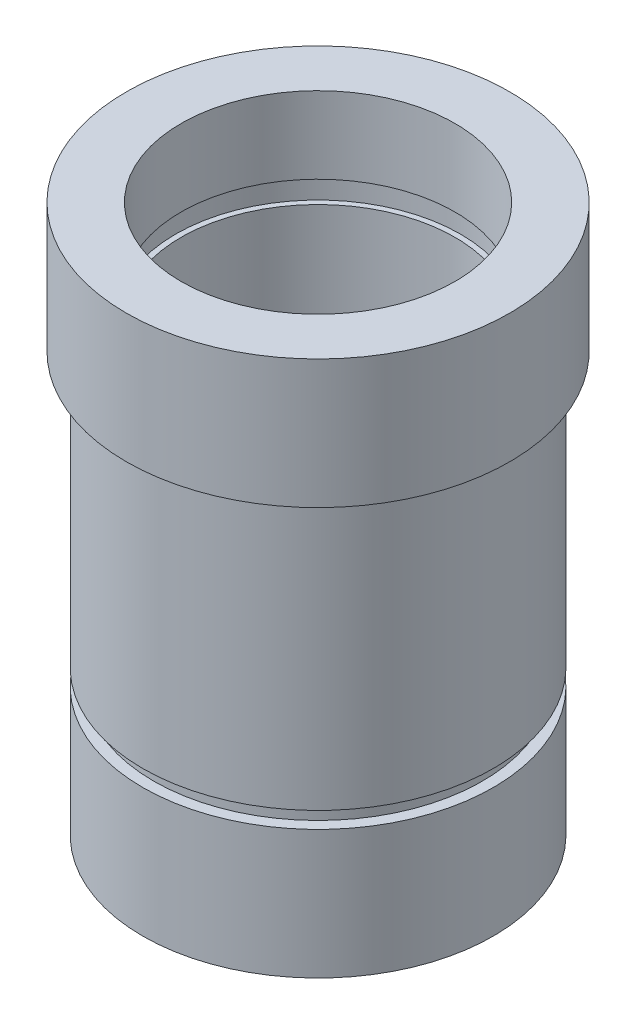
from build123d import *

# Parameters (mm, degrees)
SKETCH2_R          = 12.5
CUT_EXTRUDE1_DEPTH = 56.789784011
SKETCH3_R          = 13
CUT_EXTRUDE2_DEPTH = 2
CUT_EXTRUDE3_START = -2
SKETCH4_R          = 13
CUT_EXTRUDE3_DEPTH = 2


with BuildPart() as part:
    # Sketch1 → Revolve1 (revolve)
    with BuildSketch(Plane.XY, mode=Mode.PRIVATE) as revolve1_sk:
        Polygon((0, 23.132117765), (17.5, 23.132117765), (17.5, 11.382117765), (16, 11.382117765), (16, -13.617882235), (15, -13.617882235), (15, -15.117882235), (16, -15.117882235), (16, -26.867882235), (0, -26.867882235), align=None)
    revolve(revolve1_sk.sketch.rotate(Axis((0, 23.362720403, 0), (0, -1, 0)), 90), axis=Axis((0, 23.362720403, 0), (0, -1, 0)))

    # Sketch2 → Cut-Extrude1 (cut, through all)
    with BuildSketch(Plane(origin=(0, 23.132117765, 0), x_dir=(1, 0, 0), z_dir=(0, 1, 0))):
        with Locations(Location((0, 0, 0), (0, 0, 270))):
            Circle(SKETCH2_R)
    extrude(amount=-CUT_EXTRUDE1_DEPTH, mode=Mode.SUBTRACT)

    # Sketch3 → Cut-Extrude2 (cut)
    with BuildSketch(Plane(origin=(0, 16.132117765, 0), x_dir=(1, 0, 0), z_dir=(0, 1, 0))):
        with Locations(Location((0, 0, 0), (0, 0, 270))):
            Circle(SKETCH3_R)
    extrude(amount=-CUT_EXTRUDE2_DEPTH, mode=Mode.SUBTRACT)

    # Sketch4 → Cut-Extrude3 (cut)
    with BuildSketch(Plane(origin=(0, -19.867882235, 0), x_dir=(-1, 0, 0), z_dir=(0, -1, 0)).offset(CUT_EXTRUDE3_START)):
        with Locations(Location((0, 0, 0), (0, 0, 270))):
            Circle(SKETCH4_R)
    extrude(amount=CUT_EXTRUDE3_DEPTH, mode=Mode.SUBTRACT)


solid = part.part
